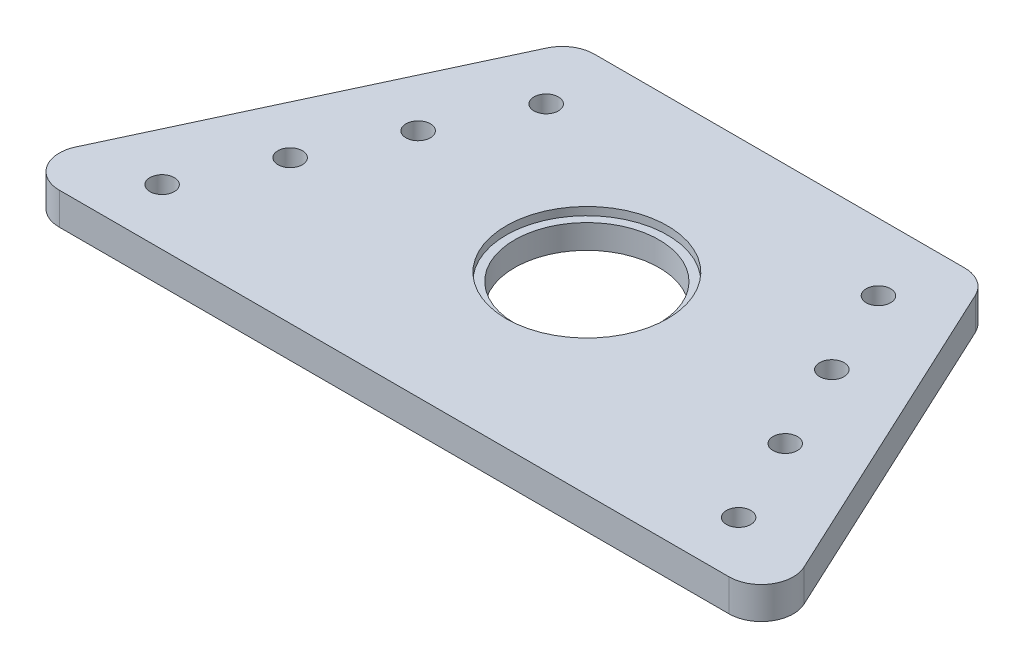
from build123d import *

# Parameters (mm, degrees)
SKETCH1_R           = 14.2875
BOSS_EXTRUDE1_DEPTH = 6.35
SKETCH2_R           = 2.413
CUT_EXTRUDE1_DEPTH  = 86.430512699
FILLET1_R           = 6.35
SKETCH3_R           = 15.9385
CUT_EXTRUDE2_DEPTH  = 1.5875


with BuildPart() as part:
    # Sketch1 → Boss-Extrude1 (new body)
    with BuildSketch(Plane(origin=(0, 0, 0), x_dir=(1, 0, 0), z_dir=(0, 1, 0))):
        Polygon((-40.667356449, 38.1), (40.667356449, 38.1), (76.2, -38.1), (-76.2, -38.1), align=None)
        with Locations(Location((0, 0, 0), (0, 0, 270))):
            Circle(SKETCH1_R, mode=Mode.SUBTRACT)
    extrude(amount=BOSS_EXTRUDE1_DEPTH)

    # Sketch2 → Cut-Extrude1 (cut, through all)
    with BuildSketch(Plane(origin=(0, 6.35, 0), x_dir=(1, 0, 0), z_dir=(0, 1, 0))):
        with Locations(Location((-57.005256578, -26.9875, 0), (0, 0, 270))):
            Circle(SKETCH2_R)
        with Locations(Location((-48.954378692, -9.722336657, 0), (0, 0, 270))):
            Circle(SKETCH2_R)
        with Locations(Location((-40.903500806, 7.542826686, 0), (0, 0, 270))):
            Circle(SKETCH2_R)
        with Locations(Location((-32.852622919, 24.807990029, 0), (0, 0, 270))):
            Circle(SKETCH2_R)
        with Locations(Location((32.852622919, 24.807990029, 0), (0, 0, 90))):
            Circle(SKETCH2_R)
        with Locations(Location((40.903500806, 7.542826686, 0), (0, 0, 90))):
            Circle(SKETCH2_R)
        with Locations(Location((48.954378692, -9.722336657, 0), (0, 0, 90))):
            Circle(SKETCH2_R)
        with Locations(Location((57.005256578, -26.9875, 0), (0, 0, 90))):
            Circle(SKETCH2_R)
    extrude(amount=-CUT_EXTRUDE1_DEPTH, mode=Mode.SUBTRACT)

    # Fillet1
    fillet1_edges = [part.edges().sort_by_distance(p)[0] for p in [
        (-40.667356449, 3.175, -38.1),
        (40.667356449, 3.175, -38.1),
        (76.2, 3.175, 38.1),
        (-76.2, 3.175, 38.1),
    ]]
    fillet(fillet1_edges, radius=FILLET1_R)

    # Sketch3 → Cut-Extrude2 (cut)
    with BuildSketch(Plane(origin=(0, 6.35, 0), x_dir=(1, 0, 0), z_dir=(0, 1, 0))):
        with Locations(Location((0, 0, 0), (0, 0, 270))):
            Circle(SKETCH3_R)
    extrude(amount=-CUT_EXTRUDE2_DEPTH, mode=Mode.SUBTRACT)


solid = part.part
